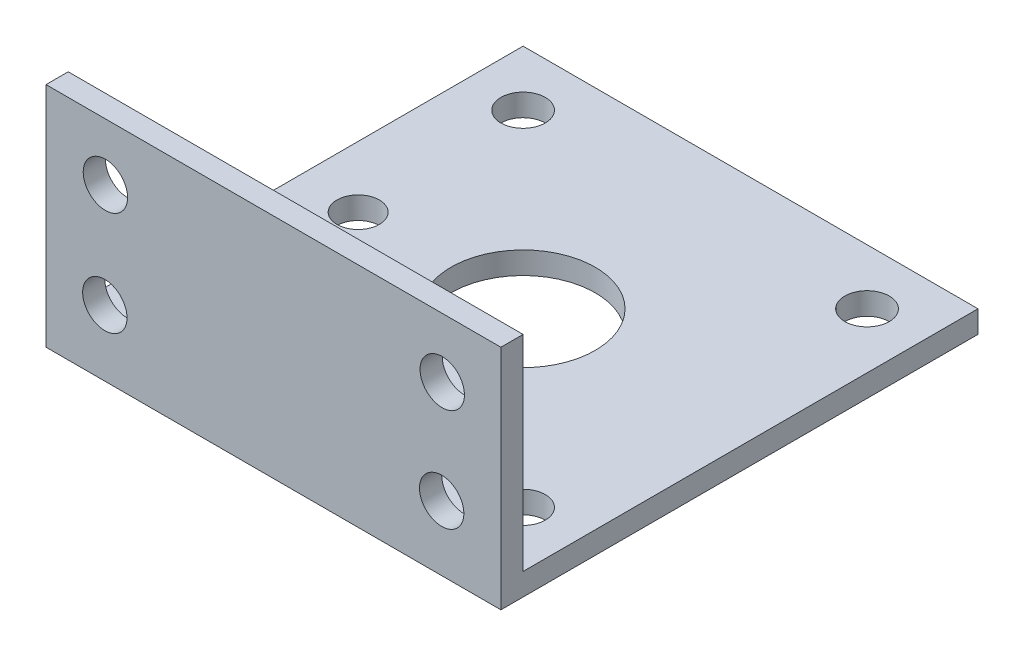
from build123d import *

# Parameters (mm, degrees)
SKETCH1_W           = 41
SKETCH1_H           = 41
SKETCH1_R           = 2
SKETCH1_R_2         = 6.5
BOSS_EXTRUDE1_DEPTH = 2
SKETCH2_W           = 41
SKETCH2_H           = 20.5
BOSS_EXTRUDE2_DEPTH = 2
SKETCH3_R           = 2
CUT_EXTRUDE1_DEPTH  = 10
SKETCH6_R           = 1.911397566
CUT_EXTRUDE4_DEPTH  = 10


with BuildPart() as part:
    # Sketch1 → Boss-Extrude1 (new body)
    with BuildSketch(Plane(origin=(0, 0, 0), x_dir=(1, 0, 0), z_dir=(0, 1, 0))):
        Rectangle(SKETCH1_W, SKETCH1_H)
        with Locations(Location((-15.5, -15.5, 0), (0, 0, 270))):
            Circle(SKETCH1_R, mode=Mode.SUBTRACT)
        with Locations(Location((-15.5, 15.5, 0), (0, 0, 270))):
            Circle(SKETCH1_R, mode=Mode.SUBTRACT)
        with Locations(Location((15.5, 15.5, 0), (0, 0, 270))):
            Circle(SKETCH1_R, mode=Mode.SUBTRACT)
        with Locations(Location((0, 0, 0), (0, 0, 270))):
            Circle(SKETCH1_R_2, mode=Mode.SUBTRACT)
        with Locations(Location((15.5, -15.5, 0), (0, 0, 270))):
            Circle(SKETCH1_R, mode=Mode.SUBTRACT)
    extrude(amount=BOSS_EXTRUDE1_DEPTH)

    # Sketch2 → Boss-Extrude2 (add)
    with BuildSketch(Plane.XY.offset(20.5)):
        with Locations((0, 10.25)):
            Rectangle(SKETCH2_W, SKETCH2_H)
    extrude(amount=BOSS_EXTRUDE2_DEPTH)

    # Sketch3 → Cut-Extrude1 (cut)
    with BuildSketch(Plane(origin=(0, 0, 20.5), x_dir=(-1, 0, 0), z_dir=(0, 0, -1))):
        with Locations((-15.161511711, 5.844100373)):
            Circle(SKETCH3_R)
        with Locations((15.146476182, 15.353198296)):
            Circle(SKETCH3_R)
        with Locations(Location((-15.210908875, 15.130767232, 0), (0, 0, 180))):
            Circle(SKETCH3_R)
        with Locations(Location((15.196521792, 5.944623662, 0), (0, 0, 180))):
            Circle(SKETCH3_R)
    extrude(amount=-CUT_EXTRUDE1_DEPTH, mode=Mode.SUBTRACT)

    # Sketch6 → Cut-Extrude4 (cut)
    with BuildSketch(Plane(origin=(0, 0, 0), x_dir=(-1, 0, 0), z_dir=(0, -1, 0))):
        with Locations(Location((14.973447389, 0.105568023, 0), (0, 0, 90))):
            Circle(SKETCH6_R)
    extrude(amount=-CUT_EXTRUDE4_DEPTH, mode=Mode.SUBTRACT)


solid = part.part
